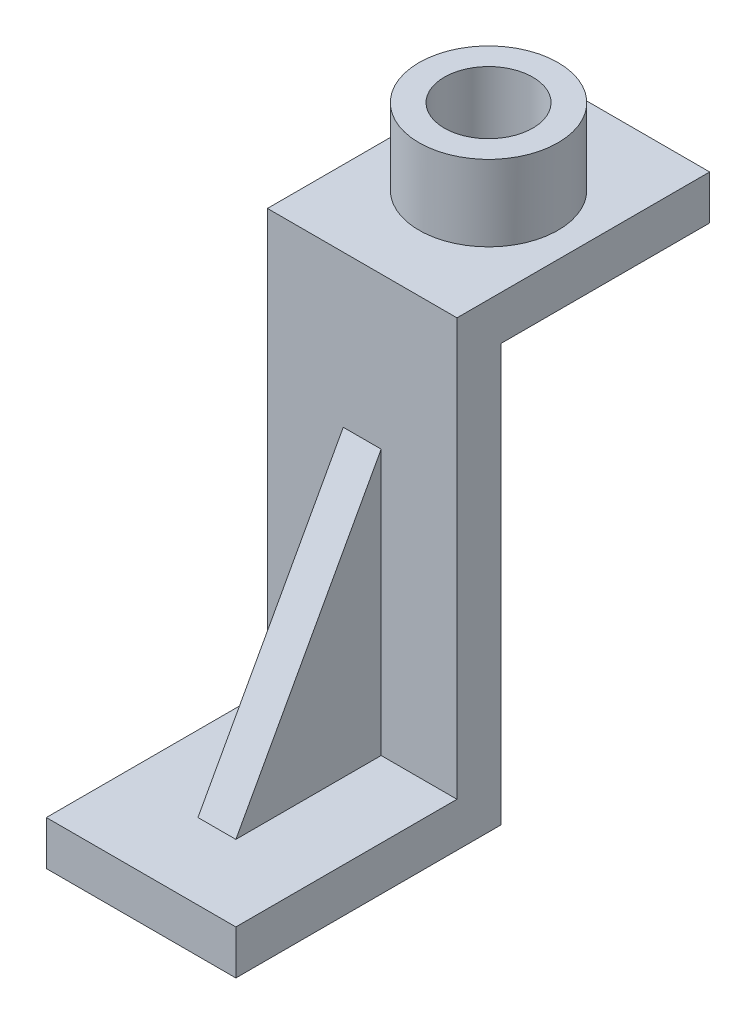
from build123d import *

# Parameters (mm, degrees)
SKETCH1_W           = 30
SKETCH1_H           = 66
BOSS_EXTRUDE1_DEPTH = 21
SKETCH2_W           = 30
SKETCH2_H           = 59
CUT_EXTRUDE1_DEPTH  = 84.785440263
SKETCH4_W           = 30
SKETCH4_H           = 7
BOSS_EXTRUDE2_DEPTH = 66
SKETCH9_W           = 30
SKETCH9_H           = 7
BOSS_EXTRUDE3_DEPTH = 40
SKETCH10_R          = 11
SKETCH10_R_2        = 7
BOSS_EXTRUDE4_DEPTH = 12
BOSS_EXTRUDE6_DEPTH = 3


with BuildPart() as part:
    # Sketch1 → Boss-Extrude1 (new, symmetric)
    with BuildSketch(Plane.XY):
        with Locations((15, 33)):
            Rectangle(SKETCH1_W, SKETCH1_H)
    extrude(amount=BOSS_EXTRUDE1_DEPTH, both=True)

    # Sketch2 → Cut-Extrude1 (cut, through all)
    with BuildSketch(Plane.XY.offset(21)):
        with Locations((15, 36.5)):
            Rectangle(SKETCH2_W, SKETCH2_H)
    extrude(amount=-CUT_EXTRUDE1_DEPTH, mode=Mode.SUBTRACT)

    # Sketch4 → Boss-Extrude2 (add)
    with BuildSketch(Plane(origin=(0, 7, 0), x_dir=(1, 0, 0), z_dir=(0, 1, 0))):
        with Locations((15, 17.5)):
            Rectangle(SKETCH4_W, SKETCH4_H)
    extrude(amount=BOSS_EXTRUDE2_DEPTH)

    # Sketch9 → Boss-Extrude3 (add)
    with BuildSketch(Plane.XY.offset(-14)):
        with Locations((15, 69.5)):
            Rectangle(SKETCH9_W, SKETCH9_H)
    extrude(amount=-BOSS_EXTRUDE3_DEPTH)

    # Sketch10 → Boss-Extrude4 (add)
    with BuildSketch(Plane(origin=(0, 73, 0), x_dir=(1, 0, 0), z_dir=(0, 1, 0))):
        with Locations(Location((15, 34, 0), (0, 0, 90))):
            Circle(SKETCH10_R)
        with Locations(Location((15, 34, 0), (0, 0, 270))):
            Circle(SKETCH10_R_2, mode=Mode.SUBTRACT)
    extrude(amount=BOSS_EXTRUDE4_DEPTH)

    # Sketch18 → Boss-Extrude6 (add, symmetric)
    with BuildSketch(Plane(origin=(15, 0, 0), x_dir=(0, 0, -1), z_dir=(1, 0, 0))):
        Polygon((14, 49), (-9, 7), (14, 7), align=None)
    extrude(amount=BOSS_EXTRUDE6_DEPTH, both=True)


solid = part.part
